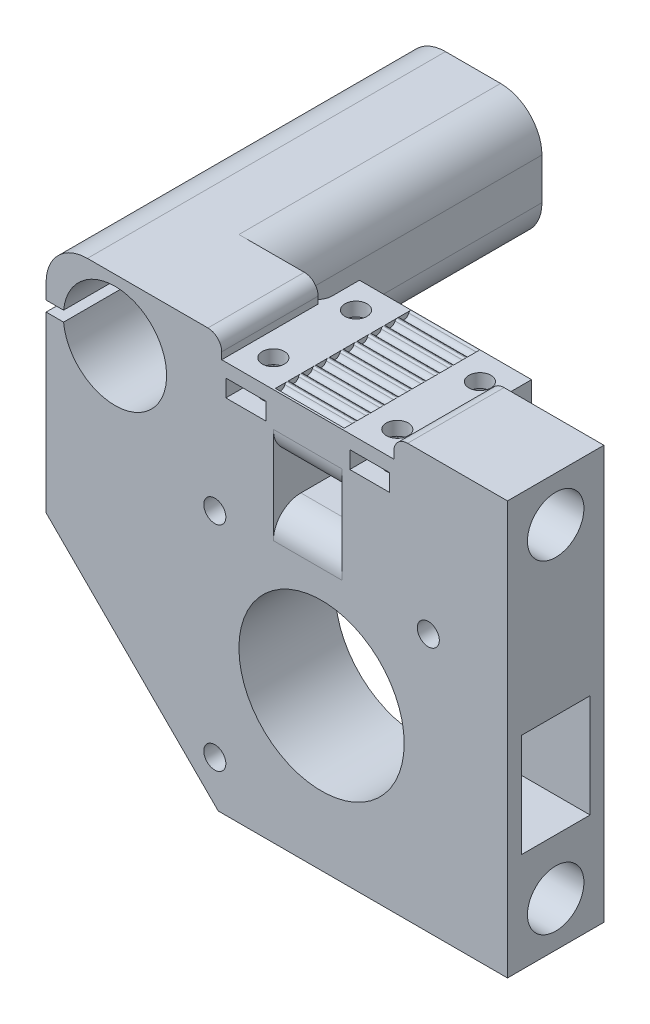
from build123d import *

# Parameters (mm, degrees)
RESSALTO_EXTRUS_O2_DEPTH   = 26
ESBO_O4_W                  = 38
ESBO_O4_H                  = 42
CORTE_EXTRUS_O1_DEPTH      = 45.452221542
ESBO_O5_W                  = 14
ESBO_O5_H                  = 60
RESSALTO_EXTRUS_O3_DEPTH   = 47
ESBO_O8_R                  = 1.6
ESBO_O8_R_2                = 12
CORTE_EXTRUS_O3_DEPTH      = 83.782848465
ESBO_O6_R                  = 4.1
CORTE_EXTRUS_O4_DEPTH      = 15
CORTE_EXTRUS_O5_REACH      = 79.878
CORTE_EXTRUS_O5_END_RADIUS = 12
ESBO_O10_W                 = 10
ESBO_O10_H                 = 15
ESBO_O12_W                 = 25
ESBO_O12_H                 = 12
RESSALTO_EXTRUS_O4_DEPTH   = 6
CORTE_EXTRUS_O6_DEPTH      = 75.786362393
CORTE_EXTRUS_O6_DEPTH_BACK = 75.786362393
ESBO_O11_W                 = 25
ESBO_O11_H                 = 3
ESBO_O13_W                 = 10
ESBO_O13_H                 = 6
CORTE_EXTRUS_O7_DEPTH      = 75.786362393
FILETE5_R                  = 4
FILETE6_R                  = 6
FILETE8_R                  = 2
FILETE9_R                  = 2
ESBO_O14_R                 = 1.6
CORTE_EXTRUS_O8_DEPTH      = 8
ESBO_O15_W                 = 5.8
ESBO_O15_H                 = 2.5
CORTE_EXTRUS_O9_DEPTH      = 7
CORTE_EXTRUS_O10_DEPTH     = 5
PADR_O_LINEAR1_COUNT       = 10
PADR_O_LINEAR1_PITCH       = 2
FILETE10_R                 = 0.3
CHANFRO1_SIZE              = 25


with BuildPart() as part:
    # Esboço1 → Ressalto-extrusão2 (new, symmetric)
    with BuildSketch(Plane.XY):
        with BuildLine():
            Line((10, 30), (-10, 30))
            Line((-10, 30), (-10, 21.75))
            Line((-10, 21.75), (-7.462405778, 21.75))
            ThreePointArc((-7.462405778, 21.75), (0.375470813, 28.490595548), (7.5, 21))
            ThreePointArc((7.5, 21), (0.375470813, 13.509404452), (-7.462405778, 20.25))
            Line((-7.462405778, 20.25), (-10, 20.25))
            Line((-10, 20.25), (-10, -30))
            Line((-10, -30), (10, -30))
            Line((10, -30), (10, 30))
        make_face()
    extrude(amount=RESSALTO_EXTRUS_O2_DEPTH, both=True)

    # Esboço4 → Corte-extrusão1 (cut, through all)
    with BuildSketch(Plane(origin=(10, 0, 0), x_dir=(0, 0, -1), z_dir=(1, 0, 0))):
        with Locations((7, -9)):
            Rectangle(ESBO_O4_W, ESBO_O4_H)
    extrude(amount=-CORTE_EXTRUS_O1_DEPTH, mode=Mode.SUBTRACT)

    # Esboço5 → Ressalto-extrusão3 (add)
    with BuildSketch(Plane(origin=(10, 0, 0), x_dir=(0, 0, -1), z_dir=(1, 0, 0))):
        with Locations((-19, 0)):
            Rectangle(ESBO_O5_W, ESBO_O5_H)
    extrude(amount=RESSALTO_EXTRUS_O3_DEPTH)

    # Esboço8 → Corte-extrusão3 (cut, through all)
    with BuildSketch(Plane.XY.offset(26)):
        with Locations((45.5, 7.5)):
            Circle(ESBO_O8_R)
        with Locations((14.5, -23.5)):
            Circle(ESBO_O8_R)
        with Locations((30, -8)):
            Circle(ESBO_O8_R_2)
        with Locations((14.5, 7.5)):
            Circle(ESBO_O8_R)
    extrude(amount=-CORTE_EXTRUS_O3_DEPTH, mode=Mode.SUBTRACT)

    # Esboço6 → Corte-extrusão4 (cut)
    with BuildSketch(Plane(origin=(57, 0, 0), x_dir=(0, 0, -1), z_dir=(1, 0, 0))):
        with Locations(Location((-19, 23.5, 0), (0, 0, 90))):
            Circle(ESBO_O6_R)
        with Locations(Location((-19, -23.5, 0), (0, 0, 270))):
            Circle(ESBO_O6_R)
    extrude(amount=-CORTE_EXTRUS_O4_DEPTH, mode=Mode.SUBTRACT)

    # Corte-extrusão5: up to this cylinder (the profile starts outside it)
    corte_extrus_o5_end = Plane(origin=(30, -8, 19), z_dir=(0, 0, 1)) * Cylinder(CORTE_EXTRUS_O5_END_RADIUS, 184.756, mode=Mode.PRIVATE)
    # Esboço10 → Corte-extrusão5 (cut, up to the surface)
    with BuildSketch(Plane(origin=(57, 0, 0), x_dir=(0, 0, -1), z_dir=(1, 0, 0)), mode=Mode.PRIVATE) as corte_extrus_o5_sk1:
        with Locations((-19, -8)):
            Rectangle(ESBO_O10_W, ESBO_O10_H)
    corte_extrus_o5_tool1 = extrude(corte_extrus_o5_sk1.sketch, amount=-CORTE_EXTRUS_O5_REACH, mode=Mode.PRIVATE) - corte_extrus_o5_end
    add(corte_extrus_o5_tool1.solids().sort_by_distance((57, -8, 19))[0], mode=Mode.SUBTRACT)

    # Esboço12 → Ressalto-extrusão4 (add)
    with BuildSketch(Plane(origin=(0, 0, 12), x_dir=(-1, 0, 0), z_dir=(0, 0, -1))):
        with Locations((-28, 24)):
            Rectangle(ESBO_O12_W, ESBO_O12_H)
    extrude(amount=RESSALTO_EXTRUS_O4_DEPTH)

    # Esboço11 → Corte-extrusão6 (cut, two sides: drawn at the far end of the back side and taken through both)
    with BuildSketch(Plane(origin=(0, 0, 12), x_dir=(-1, 0, 0), z_dir=(0, 0, -1)).offset(-CORTE_EXTRUS_O6_DEPTH_BACK)):
        with Locations((-28, 28.5)):
            Rectangle(ESBO_O11_W, ESBO_O11_H)
    extrude(amount=CORTE_EXTRUS_O6_DEPTH + CORTE_EXTRUS_O6_DEPTH_BACK, mode=Mode.SUBTRACT)

    # Esboço13 → Corte-extrusão7 (cut, through all)
    with BuildSketch(Plane(origin=(0, 0, 12), x_dir=(-1, 0, 0), z_dir=(0, 0, -1))):
        with Locations((-28, 15)):
            Rectangle(ESBO_O13_W, ESBO_O13_H)
    extrude(amount=-CORTE_EXTRUS_O7_DEPTH, mode=Mode.SUBTRACT)

    # Filete5
    filete5_edges = [part.edges().sort_by_distance(p)[0] for p in [
        (28, 18, 6),
        (28, 12, 26),
        (28, 18, 26),
        (28, 12, 12),
    ]]
    fillet(filete5_edges, radius=FILETE5_R)

    # Filete6
    filete6_edges = [part.edges().sort_by_distance(p)[0] for p in [
        (-10, 30, 0),
        (-10, 12, -7),
        (10, 12, -7),
        (10, 30, -7),
    ]]
    fillet(filete6_edges, radius=FILETE6_R)

    # Filete8
    filete8_edges = [part.edges().sort_by_distance(p)[0] for p in [
        (40.5, 22.5, 12),
        (15.5, 22.5, 12),
    ]]
    fillet(filete8_edges, radius=FILETE8_R)

    # Filete9
    filete9_edges = [part.edges().sort_by_distance(p)[0] for p in [
        (15.5, 30, 19),
        (40.5, 30, 19),
    ]]
    fillet(filete9_edges, radius=FILETE9_R)

    # Esboço14 → Corte-extrusão8 (cut)
    with BuildSketch(Plane(origin=(0, 27, 0), x_dir=(1, 0, 0), z_dir=(0, 1, 0))):
        with Locations(Location((19, -22, 0), (0, 0, 270))):
            Circle(ESBO_O14_R)
        with Locations(Location((37, -22, 0), (0, 0, 90))):
            Circle(ESBO_O14_R)
        with Locations(Location((37, -10, 0), (0, 0, 270))):
            Circle(ESBO_O14_R)
        with Locations(Location((19, -10, 0), (0, 0, 90))):
            Circle(ESBO_O14_R)
    extrude(amount=-CORTE_EXTRUS_O8_DEPTH, mode=Mode.SUBTRACT)

    # Esboço15 → Corte-extrusão9 (cut)
    with BuildSketch(Plane.XY.offset(26)):
        with Locations((19, 23.75)):
            Rectangle(ESBO_O15_W, ESBO_O15_H)
        with Locations((37, 23.75)):
            Rectangle(ESBO_O15_W, ESBO_O15_H)
    corte_extrus_o9 = extrude(amount=-CORTE_EXTRUS_O9_DEPTH, mode=Mode.SUBTRACT)

    # Espelhar1: Corte-extrusão9 across plane
    add(corte_extrus_o9.mirror(Plane.XY.offset(16)), mode=Mode.SUBTRACT)

    # Esboço16 → Corte-extrusão10 (cut, symmetric)
    with BuildSketch(Plane(origin=(28, 0, 0), x_dir=(0, 0, -1), z_dir=(1, 0, 0))):
        with BuildLine():
            Line((-7.7, 27), (-6.3, 27))
            ThreePointArc((-6.3, 27), (-7, 26.3), (-7.7, 27))
        make_face()
    corte_extrus_o10 = extrude(amount=CORTE_EXTRUS_O10_DEPTH, both=True, mode=Mode.SUBTRACT)

    # Padrão linear1: Corte-extrusão10 ×10
    with Locations(*[(0, 0, i * PADR_O_LINEAR1_PITCH) for i in range(1, PADR_O_LINEAR1_COUNT)]):
        add(corte_extrus_o10, mode=Mode.SUBTRACT)

    # Filete10
    filete10_edges = [part.edges().sort_by_distance(p)[0] for p in [
        (28, 27, 7.7),
        (28, 27, 6.3),
        (28, 27, 9.7),
        (28, 27, 8.3),
        (28, 27, 11.7),
        (28, 27, 10.3),
        (28, 27, 13.7),
        (28, 27, 12.3),
        (28, 27, 15.7),
        (28, 27, 14.3),
        (28, 27, 17.7),
        (28, 27, 16.3),
        (28, 27, 19.7),
        (28, 27, 18.3),
        (28, 27, 21.7),
        (28, 27, 20.3),
        (28, 27, 23.7),
        (28, 27, 22.3),
        (28, 27, 24.3),
    ]]
    fillet(filete10_edges, radius=FILETE10_R)

    # Chanfro1
    chanfro1_edges = [part.edges().sort_by_distance(p)[0] for p in [
        (-10, -30, 19),
    ]]
    chamfer(chanfro1_edges, length=CHANFRO1_SIZE)


solid = part.part
